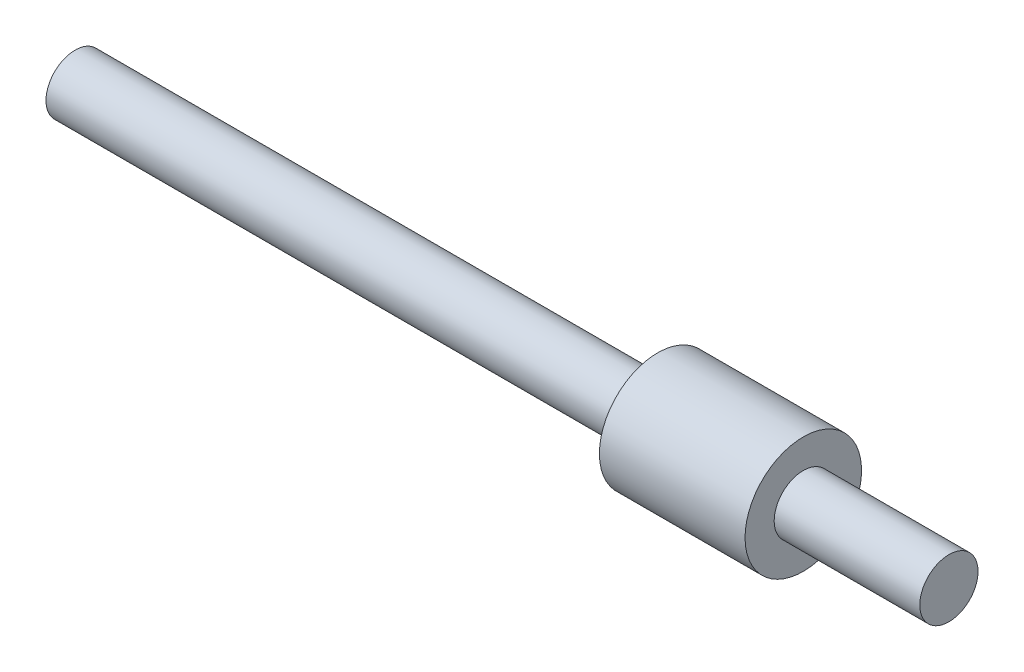
from build123d import *


with BuildPart() as part:
    # Szkic1 → Obrót1 (revolve)
    with BuildSketch(Plane.XY, mode=Mode.PRIVATE) as obr_t1_sk:
        Polygon((0, 0), (0, 5), (100, 5), (100, 10), (125, 10), (125, 5), (150, 5), (150, 0), align=None)
    revolve(obr_t1_sk.sketch.rotate(Axis((0, 0, 0), (1, 0, 0)), 90), axis=Axis((0, 0, 0), (1, 0, 0)))


solid = part.part
